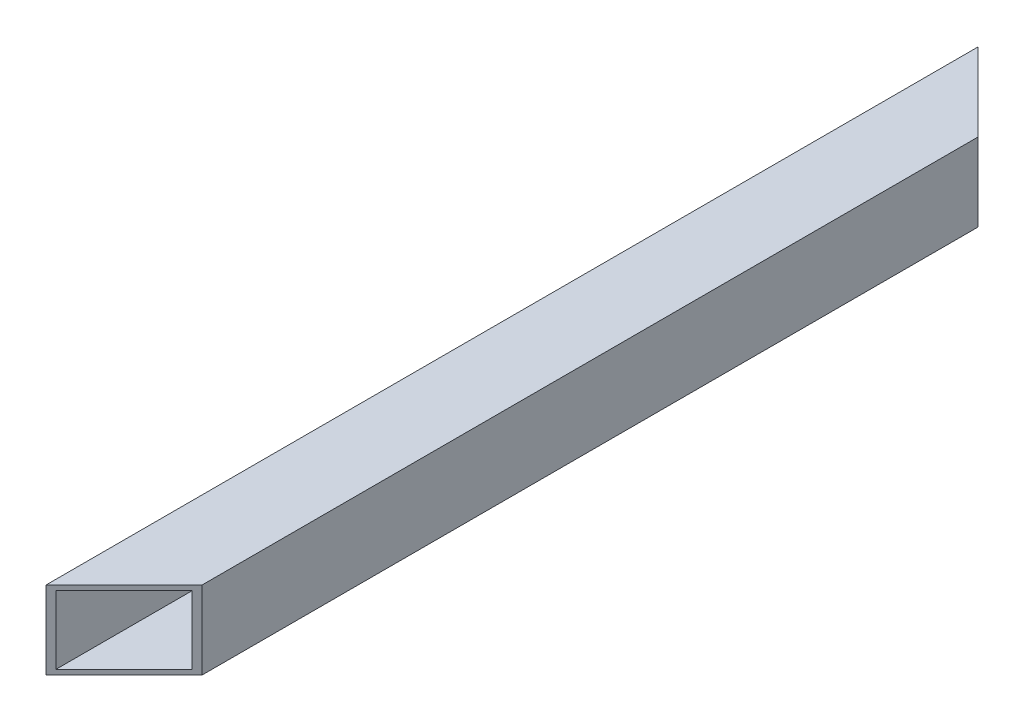
from build123d import *

# Parameters (mm, degrees)
SKETCH1_W           = 19
SKETCH1_H           = 19
SKETCH1_W_2         = 16.6
SKETCH1_H_2         = 16.6
BOSS_EXTRUDE1_DEPTH = 113.49
CUT_EXTRUDE1_DEPTH  = 116.460946211


with BuildPart() as part:
    # Sketch1 → Boss-Extrude1 (new, symmetric)
    with BuildSketch(Plane.XY):
        Rectangle(SKETCH1_W, SKETCH1_H)
        Rectangle(SKETCH1_W_2, SKETCH1_H_2, mode=Mode.SUBTRACT)
    extrude(amount=BOSS_EXTRUDE1_DEPTH, both=True)

    # Sketch2 → Cut-Extrude1 (cut, through all)
    with BuildSketch(Plane(origin=(0, 9.5, 0), x_dir=(1, 0, 0), z_dir=(0, 1, 0))):
        Polygon((-9.5, -113.49), (9.5, -113.49), (9.5, -94.49), align=None)
        Polygon((-9.5, 113.49), (9.5, 113.49), (9.5, 94.49), align=None)
    extrude(amount=-CUT_EXTRUDE1_DEPTH, mode=Mode.SUBTRACT)


solid = part.part
